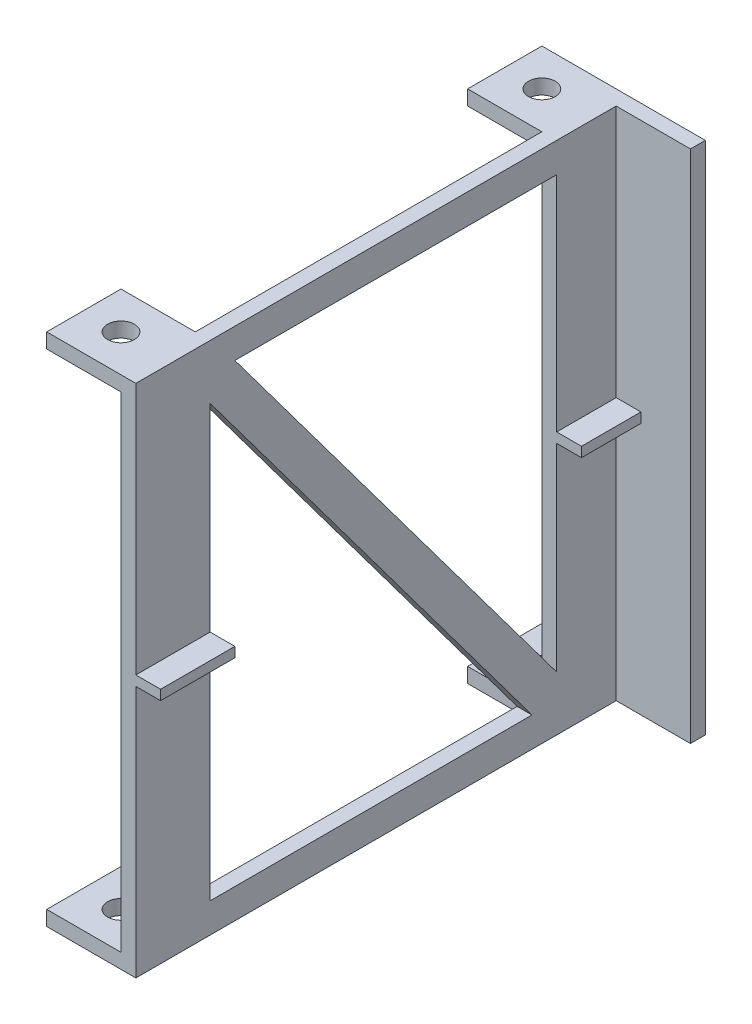
from build123d import *

# Parameters (mm, degrees)
SKETCH2_W           = 15
SKETCH2_H           = 15
BOSS_EXTRUDE1_DEPTH = 3
SKETCH3_W           = 3
SKETCH3_H           = 15
BOSS_EXTRUDE2_DEPTH = 104
SKETCH4_W           = 15
SKETCH4_H           = 3
BOSS_EXTRUDE3_DEPTH = 15
SKETCH5_R           = 2.7
CUT_EXTRUDE1_DEPTH  = 105.999550604
SKETCH6_W           = 15
SKETCH6_H           = 2
BOSS_EXTRUDE4_DEPTH = 5
BOSS_EXTRUDE5_DEPTH = 3
SKETCH9_W           = 3
SKETCH9_H           = 104
BOSS_EXTRUDE6_DEPTH = 15


with BuildPart() as part:
    # Sketch2 → Boss-Extrude1 (new body)
    with BuildSketch(Plane(origin=(0, 0, 0), x_dir=(1, 0, 0), z_dir=(0, 1, 0))):
        with Locations((-4.400493642, 0.702675063)):
            Rectangle(SKETCH2_W, SKETCH2_H)
    extrude(amount=BOSS_EXTRUDE1_DEPTH)

    # Sketch3 → Boss-Extrude2 (add)
    with BuildSketch(Plane(origin=(0, 0, 0), x_dir=(1, 0, 0), z_dir=(0, 1, 0))):
        with Locations((4.599506358, 0.702675063)):
            Rectangle(SKETCH3_W, SKETCH3_H)
    extrude(amount=BOSS_EXTRUDE2_DEPTH)

    # Sketch4 → Boss-Extrude3 (add)
    with BuildSketch(Plane.ZY.offset(-3.099506358)):
        with Locations((-0.702675063, 102.5)):
            Rectangle(SKETCH4_W, SKETCH4_H)
    extrude(amount=BOSS_EXTRUDE3_DEPTH)

    # Sketch5 → Cut-Extrude1 (cut, through all)
    with BuildSketch(Plane.XZ):
        with Locations(Location((-4.400493642, -0.702675063, 0), (0, 0, 270))):
            Circle(SKETCH5_R)
    extrude(amount=-CUT_EXTRUDE1_DEPTH, mode=Mode.SUBTRACT)

    # Sketch6 → Boss-Extrude4 (add)
    with BuildSketch(Plane(origin=(6.099506358, 0, 0), x_dir=(0, 0, -1), z_dir=(1, 0, 0))):
        with Locations((0.702675063, 52)):
            Rectangle(SKETCH6_W, SKETCH6_H)
    extrude(amount=BOSS_EXTRUDE4_DEPTH)


with BuildPart() as body_2:
    # Body-Move/Copy2: copy of part
    add(part.part.moved(Location((0, 0, 85))))


with BuildPart() as part_1:
    add(part.part)

    add(body_2.part)  # Boss-Extrude5 merges body 2
    # Sketch8 → Boss-Extrude5 (add)
    with BuildSketch(Plane.ZY.offset(-6.099506358)):
        Polygon((6.797324937, 104), (76.797324937, 104), (76.797324937, 98), (76.797324937, 93), (11.797324937, 6), (76.797324937, 6), (76.797324937, 0), (6.797324937, 0), (6.797324937, 6), (6.797324937, 11), (71.797324937, 98), (6.797324937, 98), align=None)
    extrude(amount=BOSS_EXTRUDE5_DEPTH)

    # Sketch9 → Boss-Extrude6 (add)
    with BuildSketch(Plane(origin=(6.099506358, 0, 0), x_dir=(0, 0, -1), z_dir=(1, 0, 0))):
        with Locations((6.702675063, 52)):
            Rectangle(SKETCH9_W, SKETCH9_H)
    extrude(amount=BOSS_EXTRUDE6_DEPTH)


solid = part_1.part
